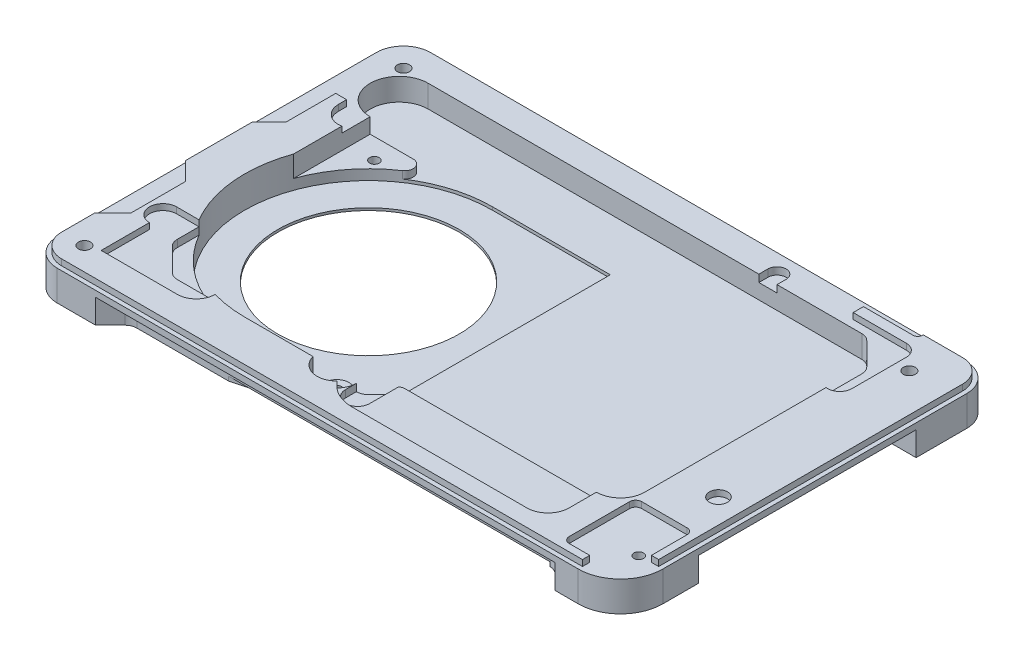
from build123d import *

# Parameters (mm, degrees)
BOSS_EXTRUDE2_DEPTH = 5
CUT_EXTRUDE2_DEPTH  = 4
BOSS_EXTRUDE4_START = 1.2
BOSS_EXTRUDE4_DEPTH = 1.2
CUT_EXTRUDE4_REACH  = 69.347
CUT_EXTRUDE5_DEPTH  = 1
SKETCH13_R          = 1
SKETCH13_R_2        = 0.8
CUT_EXTRUDE6_DEPTH  = 58.935434753
CUT_EXTRUDE8_DEPTH  = 0.7
CUT_EXTRUDE10_DEPTH = 3.7
BOSS_EXTRUDE5_START = 1
SKETCH17_R          = 1
SKETCH17_R_2        = 1.5
BOSS_EXTRUDE5_DEPTH = 1
CUT_EXTRUDE11_DEPTH = 1.2
SKETCH19_R          = 20
CUT_EXTRUDE12_DEPTH = 0.4
SKETCH20_R          = 15
CUT_EXTRUDE13_DEPTH = 59.067844802
CUT_EXTRUDE14_DEPTH = 0.5
BOSS_EXTRUDE6_START = 1.2
SKETCH23_R          = 0.8
BOSS_EXTRUDE6_DEPTH = 1.2
BOSS_EXTRUDE7_START = 2.5
BOSS_EXTRUDE7_DEPTH = 2.5


with BuildPart() as part:
    # Sketch5 → Boss-Extrude2 (new body)
    with BuildSketch(Plane(origin=(0, 0, 0), x_dir=(1, 0, 0), z_dir=(0, 1, 0))):
        with BuildLine():
            Line((-44.35, -30.89), (41.85, -30.89))
            ThreePointArc((41.85, -30.89), (46.799747468, -28.839747468), (48.85, -23.89))
            Line((48.85, -23.89), (48.85, 26.39))
            ThreePointArc((48.85, 26.39), (47.531980515, 29.571980515), (44.35, 30.89))
            Line((44.35, 30.89), (-44.35, 30.89))
            ThreePointArc((-44.35, 30.89), (-47.531980515, 29.571980515), (-48.85, 26.39))
            Line((-48.85, 26.39), (-48.85, -26.39))
            ThreePointArc((-48.85, -26.39), (-47.531980515, -29.571980515), (-44.35, -30.89))
        make_face()
    extrude(amount=BOSS_EXTRUDE2_DEPTH)

    # Sketch10 → Cut-Extrude2 (cut)
    with BuildSketch(Plane.XZ):
        with BuildLine():
            Line((-48.85, 18), (-44.435786438, 13.585786438))
            ThreePointArc((-44.435786438, 13.585786438), (-44.002240935, 12.93693974), (-43.85, 12.171572875))
            Line((-43.85, 12.171572875), (-43.85, -12.171572875))
            ThreePointArc((-43.85, -12.171572875), (-44.002240935, -12.93693974), (-44.435786438, -13.585786438))
            Line((-44.435786438, -13.585786438), (-48.85, -18))
            Line((-48.85, -18), (-48.85, 18))
        make_face()
        with BuildLine():
            Line((-38, -30.89), (-35.585786438, -28.475786438))
            ThreePointArc((-35.585786438, -28.475786438), (-34.93693974, -28.042240935), (-34.171572875, -27.89))
            Line((-34.171572875, -27.89), (34.171572875, -27.89))
            ThreePointArc((34.171572875, -27.89), (34.93693974, -28.042240935), (35.585786438, -28.475786438))
            Line((35.585786438, -28.475786438), (38, -30.89))
            Line((38, -30.89), (-38, -30.89))
        make_face()
        with BuildLine():
            Line((-38, 30.89), (38, 30.89))
            Line((38, 30.89), (35.585786438, 28.475786438))
            ThreePointArc((35.585786438, 28.475786438), (34.93693974, 28.042240935), (34.171572875, 27.89))
            Line((34.171572875, 27.89), (-34.171572875, 27.89))
            ThreePointArc((-34.171572875, 27.89), (-34.93693974, 28.042240935), (-35.585786438, 28.475786438))
            Line((-35.585786438, 28.475786438), (-38, 30.89))
        make_face()
        with BuildLine():
            Line((36.85, 18), (48.85, 18))
            Line((48.85, 18), (48.85, -18))
            Line((48.85, -18), (36.85, -18))
            ThreePointArc((36.85, -18), (35.45, -16.6), (36.85, -15.2))
            Line((36.85, -15.2), (44.85, -15.2))
            Line((44.85, -15.2), (44.85, -14.1))
            Line((44.85, -14.1), (36.85, -14.1))
            ThreePointArc((36.85, -14.1), (35.772222222, -13.022222222), (36.85, -11.944444444))
            Line((36.85, -11.944444444), (44.85, -11.944444444))
            Line((44.85, -11.944444444), (44.85, -10.844444444))
            Line((44.85, -10.844444444), (36.85, -10.844444444))
            ThreePointArc((36.85, -10.844444444), (35.772222222, -9.766666667), (36.85, -8.688888889))
            Line((36.85, -8.688888889), (44.85, -8.688888889))
            Line((44.85, -8.688888889), (44.85, -7.588888889))
            Line((44.85, -7.588888889), (36.85, -7.588888889))
            ThreePointArc((36.85, -7.588888889), (35.772222222, -6.511111111), (36.85, -5.433333333))
            Line((36.85, -5.433333333), (44.85, -5.433333333))
            Line((44.85, -5.433333333), (44.85, -4.333333333))
            Line((44.85, -4.333333333), (36.85, -4.333333333))
            ThreePointArc((36.85, -4.333333333), (35.772222222, -3.255555556), (36.85, -2.177777778))
            Line((36.85, -2.177777778), (44.85, -2.177777778))
            Line((44.85, -2.177777778), (44.85, -1.077777778))
            Line((44.85, -1.077777778), (36.85, -1.077777778))
            ThreePointArc((36.85, -1.077777778), (35.772222222, 0), (36.85, 1.077777778))
            Line((36.85, 1.077777778), (44.85, 1.077777778))
            Line((44.85, 1.077777778), (44.85, 2.177777778))
            Line((44.85, 2.177777778), (36.85, 2.177777778))
            ThreePointArc((36.85, 2.177777778), (35.772222222, 3.255555556), (36.85, 4.333333333))
            Line((36.85, 4.333333333), (44.85, 4.333333333))
            Line((44.85, 4.333333333), (44.85, 5.433333333))
            Line((44.85, 5.433333333), (36.85, 5.433333333))
            ThreePointArc((36.85, 5.433333333), (35.772222222, 6.511111111), (36.85, 7.588888889))
            Line((36.85, 7.588888889), (44.85, 7.588888889))
            Line((44.85, 7.588888889), (44.85, 8.688888889))
            Line((44.85, 8.688888889), (36.85, 8.688888889))
            ThreePointArc((36.85, 8.688888889), (35.772222222, 9.766666667), (36.85, 10.844444444))
            Line((36.85, 10.844444444), (44.85, 10.844444444))
            Line((44.85, 10.844444444), (44.85, 11.944444444))
            Line((44.85, 11.944444444), (36.85, 11.944444444))
            ThreePointArc((36.85, 11.944444444), (35.772222222, 13.022222222), (36.85, 14.1))
            Line((36.85, 14.1), (44.85, 14.1))
            Line((44.85, 14.1), (44.85, 15.2))
            Line((44.85, 15.2), (36.85, 15.2))
            ThreePointArc((36.85, 15.2), (35.45, 16.6), (36.85, 18))
        make_face()
    extrude(amount=-CUT_EXTRUDE2_DEPTH, mode=Mode.SUBTRACT)

    # Sketch11 → Boss-Extrude4 (add)
    with BuildSketch(Plane.XZ.offset(-4).offset(BOSS_EXTRUDE4_START)):
        with BuildLine():
            Line((-35.585786438, -28.475786438), (-36.5, -29.39))
            Line((-36.5, -29.39), (36.5, -29.39))
            Line((36.5, -29.39), (35.585786438, -28.475786438))
            ThreePointArc((35.585786438, -28.475786438), (34.93693974, -28.042240935), (34.171572875, -27.89))
            Line((34.171572875, -27.89), (-34.171572875, -27.89))
            ThreePointArc((-34.171572875, -27.89), (-34.93693974, -28.042240935), (-35.585786438, -28.475786438))
        make_face()
        with BuildLine():
            Line((-36.5, 29.39), (-35.585786438, 28.475786438))
            ThreePointArc((-35.585786438, 28.475786438), (-34.93693974, 28.042240935), (-34.171572875, 27.89))
            Line((-34.171572875, 27.89), (34.171572875, 27.89))
            ThreePointArc((34.171572875, 27.89), (34.93693974, 28.042240935), (35.585786438, 28.475786438))
            Line((35.585786438, 28.475786438), (36.5, 29.39))
            Line((36.5, 29.39), (-36.5, 29.39))
        make_face()
    extrude(amount=-BOSS_EXTRUDE4_DEPTH)

    # Cut-Extrude4: up to this face of the body (flat: up to its plane)
    cut_extrude4_end = Plane(part.part.faces().sort_by_distance((40.85, 2, 15.2))[0])
    # Sketch12 → Cut-Extrude4 (cut, up to the picked face)
    with BuildSketch(Plane(origin=(0, 0, -15.2), x_dir=(-1, 0, 0), z_dir=(0, 0, -1)), mode=Mode.PRIVATE) as cut_extrude4_sk1:
        Polygon((-44.85, 4), (-36.85, 0), (-44.85, 0), align=None)
    cut_extrude4_tool1 = split(extrude(cut_extrude4_sk1.sketch, amount=-CUT_EXTRUDE4_REACH, mode=Mode.PRIVATE), bisect_by=cut_extrude4_end, keep=Keep.BOTH, mode=Mode.PRIVATE)
    add(cut_extrude4_tool1.solids().sort_by(Axis((42.183333, 1.333333, -15.2), (0, 0, 1)))[0], mode=Mode.SUBTRACT)

    # Sketch6 → Cut-Extrude5 (cut)
    with BuildSketch(Plane.XZ):
        with BuildLine():
            Line((-47.95, 26.39), (-47.95, 20.236616051))
            ThreePointArc((-47.95, 20.236616051), (-47.575727394, 19.456574239), (-46.733069542, 19.260428991))
            Line((-46.733069542, 19.260428991), (-39.733069542, 20.815984546))
            ThreePointArc((-39.733069542, 20.815984546), (-39.169958188, 21.166444213), (-38.95, 21.792171606))
            Line((-38.95, 21.792171606), (-38.95, 28.99))
            ThreePointArc((-38.95, 28.99), (-39.242893219, 29.697106781), (-39.95, 29.99))
            Line((-39.95, 29.99), (-44.35, 29.99))
            ThreePointArc((-44.35, 29.99), (-46.895584412, 28.935584412), (-47.95, 26.39))
        make_face()
        with BuildLine():
            Line((39.95, 29.99), (41.85, 29.99))
            ThreePointArc((41.85, 29.99), (46.163351365, 28.203351365), (47.95, 23.89))
            Line((47.95, 23.89), (47.95, 20.236616051))
            ThreePointArc((47.95, 20.236616051), (47.575727394, 19.456574239), (46.733069542, 19.260428991))
            Line((46.733069542, 19.260428991), (39.733069542, 20.815984546))
            ThreePointArc((39.733069542, 20.815984546), (39.169958188, 21.166444213), (38.95, 21.792171606))
            Line((38.95, 21.792171606), (38.95, 28.99))
            ThreePointArc((38.95, 28.99), (39.242893219, 29.697106781), (39.95, 29.99))
        make_face()
        with BuildLine():
            Line((48.765806971, -22.89), (47.95, -20.236616051))
            ThreePointArc((47.95, -20.236616051), (47.575727394, -19.456574239), (46.733069542, -19.260428991))
            Line((46.733069542, -19.260428991), (39.733069542, -20.815984546))
            ThreePointArc((39.733069542, -20.815984546), (39.169958188, -21.166444213), (38.95, -21.792171606))
            Line((38.95, -21.792171606), (38.95, -28.99))
            ThreePointArc((38.95, -28.99), (39.242893219, -29.697106781), (39.95, -29.99))
            Line((39.95, -29.99), (44.499911272, -30.355783503))
            ThreePointArc((44.499911272, -30.355783503), (47.917142837, -27.35672235), (48.765806971, -22.89))
        make_face()
        with BuildLine():
            Line((-39.95, -29.99), (-44.35, -29.99))
            ThreePointArc((-44.35, -29.99), (-46.895584412, -28.935584412), (-47.95, -26.39))
            Line((-47.95, -26.39), (-47.95, -20.236616051))
            ThreePointArc((-47.95, -20.236616051), (-47.575727394, -19.456574239), (-46.733069542, -19.260428991))
            Line((-46.733069542, -19.260428991), (-39.733069542, -20.815984546))
            ThreePointArc((-39.733069542, -20.815984546), (-39.169958188, -21.166444213), (-38.95, -21.792171606))
            Line((-38.95, -21.792171606), (-38.95, -28.99))
            ThreePointArc((-38.95, -28.99), (-39.242893219, -29.697106781), (-39.95, -29.99))
        make_face()
    extrude(amount=-CUT_EXTRUDE5_DEPTH, mode=Mode.SUBTRACT)

    # Sketch13 → Cut-Extrude6 (cut, through all)
    with BuildSketch(Plane.XZ.offset(-1)):
        with Locations(Location((-44.35, 26.39, 0), (0, 0, 270))):
            Circle(SKETCH13_R)
        with Locations(Location((-44.35, -26.39, 0), (0, 0, 270))):
            Circle(SKETCH13_R)
        with Locations(Location((41.85, -23.89, 0), (0, 0, 270))):
            Circle(SKETCH13_R)
        with Locations(Location((44.95, 23.99, 0), (0, 0, 270))):
            Circle(SKETCH13_R_2)
    extrude(amount=-CUT_EXTRUDE6_DEPTH, mode=Mode.SUBTRACT)

    # Sketch15 → Cut-Extrude8 (cut)
    with BuildSketch(Plane.XZ):
        with BuildLine():
            Line((-19, 27.89), (22.593753701, 16.89))
            ThreePointArc((22.593753701, 16.89), (23.62588171, 16.89252022), (24.519313117, 17.409313117))
            Line((24.519313117, 17.409313117), (35, 27.89))
            Line((35, 27.89), (-19, 27.89))
        make_face()
        with BuildLine():
            Line((35, -27.89), (-19, -27.89))
            Line((-19, -27.89), (22.593753701, -16.89))
            ThreePointArc((22.593753701, -16.89), (23.62588171, -16.89252022), (24.519313117, -17.409313117))
            Line((24.519313117, -17.409313117), (35, -27.89))
        make_face()
    extrude(amount=-CUT_EXTRUDE8_DEPTH, mode=Mode.SUBTRACT)

    # Sketch16 → Cut-Extrude10 (cut)
    with BuildSketch(Plane(origin=(0, 5, 0), x_dir=(1, 0, 0), z_dir=(0, 1, 0))):
        with BuildLine():
            Line((-40.15, 26.29), (31.571825407, 26.29))
            ThreePointArc((31.571825407, 26.29), (32.337192272, 26.137759065), (32.986038969, 25.704213562))
            Line((32.986038969, 25.704213562), (36.764213562, 21.926038969))
            ThreePointArc((36.764213562, 21.926038969), (37.197759065, 21.277192272), (37.35, 20.511825407))
            Line((37.35, 20.511825407), (37.35, -15.39))
            ThreePointArc((37.35, -15.39), (36.178427125, -18.218427125), (33.35, -19.39))
            Line((33.35, -19.39), (1.806854249, -19.39))
            ThreePointArc((1.806854249, -19.39), (1.041487385, -19.542240935), (0.392640687, -19.975786438))
            Line((0.392640687, -19.975786438), (-1.685786438, -22.054213562))
            ThreePointArc((-1.685786438, -22.054213562), (-2.334633135, -22.487759065), (-3.1, -22.64))
            ThreePointArc((-3.1, -22.64), (-5.972443644, -25.867994919), (-9.51227766, -23.39))
            Line((-9.51227766, -23.39), (-20.85, -23.39))
            ThreePointArc((-20.85, -23.39), (-23.713564213, -23.189014754), (-26.520978752, -22.59))
            Line((-26.520978752, -22.59), (-32.771825407, -22.59))
            ThreePointArc((-32.771825407, -22.59), (-33.537192272, -22.437759065), (-34.186038969, -22.004213562))
            Line((-34.186038969, -22.004213562), (-37.964213562, -18.226038969))
            ThreePointArc((-37.964213562, -18.226038969), (-38.397759065, -17.577192272), (-38.55, -16.811825407))
            Line((-38.55, -16.811825407), (-38.55, -13.232146779))
            ThreePointArc((-38.55, -13.232146779), (-41.262412143, -4.782995112), (-40.15, 4.020861017))
            Line((-40.15, 4.020861017), (-40.15, 16.69))
            ThreePointArc((-40.15, 16.69), (-44.95, 21.49), (-40.15, 26.29))
        make_face()
    extrude(amount=-CUT_EXTRUDE10_DEPTH, mode=Mode.SUBTRACT)

    # Sketch17 → Boss-Extrude5 (add)
    with BuildSketch(Plane(origin=(0, 5, 0), x_dir=(1, 0, 0), z_dir=(0, 1, 0)).offset(BOSS_EXTRUDE5_START)):
        with BuildLine():
            Line((-45.15, -17.89), (-48.15, -20.89))
            Line((-48.15, -20.89), (-48.15, -26.39))
            ThreePointArc((-48.15, -26.39), (-47.037005769, -29.077005769), (-44.35, -30.19))
            Line((-44.35, -30.19), (41.85, -30.19))
            Line((41.85, -30.19), (41.85, -28.99))
            Line((41.85, -28.99), (38.45, -28.99))
            ThreePointArc((38.45, -28.99), (37.742893219, -28.697106781), (37.45, -27.99))
            Line((37.45, -27.99), (37.45, -17.99))
            ThreePointArc((37.45, -17.99), (37.742893219, -17.282893219), (38.45, -16.99))
            Line((38.45, -16.99), (45.95, -16.99))
            ThreePointArc((45.95, -16.99), (46.657106781, -17.282893219), (46.95, -17.99))
            Line((46.95, -17.99), (46.95, -23.89))
            Line((46.95, -23.89), (48.15, -23.89))
            Line((48.15, -23.89), (48.15, 26.39))
            ThreePointArc((48.15, 26.39), (47.037005769, 29.077005769), (44.35, 30.19))
            Line((44.35, 30.19), (37.85, 30.19))
            Line((37.85, 30.19), (37.85, 30.09))
            ThreePointArc((37.85, 30.09), (37.615685425, 29.524314575), (37.05, 29.29))
            Line((37.05, 29.29), (28.85, 29.29))
            Line((28.85, 29.29), (28.85, 27.59))
            Line((28.85, 27.59), (37.65, 27.59))
            ThreePointArc((37.65, 27.59), (39.064213562, 27.004213562), (39.65, 25.59))
            Line((39.65, 25.59), (39.65, 16.59))
            ThreePointArc((39.65, 16.59), (39.064213562, 15.175786438), (37.65, 14.59))
            Line((37.65, 14.59), (37.35, 14.59))
            Line((37.35, 14.59), (37.35, -15.39))
            ThreePointArc((37.35, -15.39), (36.178427125, -18.218427125), (33.35, -19.39))
            Line((33.35, -19.39), (33.35, -23.89))
            ThreePointArc((33.35, -23.89), (32.324873734, -26.364873734), (29.85, -27.39))
            Line((29.85, -27.39), (0.885281374, -27.39))
            ThreePointArc((0.885281374, -27.39), (-1.41081922, -26.933277195), (-3.357359313, -25.632640687))
            Line((-3.357359313, -25.632640687), (-4.051902961, -24.938097039))
            ThreePointArc((-4.051902961, -24.938097039), (-7.236483585, -25.766762999), (-9.51227766, -23.39))
            Line((-9.51227766, -23.39), (-20.85, -23.39))
            ThreePointArc((-20.85, -23.39), (-23.713564213, -23.189014754), (-26.520978752, -22.59))
            ThreePointArc((-26.520978752, -22.59), (-27.43639405, -24.800008029), (-29.646402079, -25.715423328))
            Line((-29.646402079, -25.715423328), (-42.25, -25.715423328))
            Line((-42.25, -25.715423328), (-42.25, -17.732146779))
            ThreePointArc((-42.25, -17.732146779), (-44.5, -15.482146779), (-42.25, -13.232146779))
            Line((-42.25, -13.232146779), (-38.55, -13.232146779))
            ThreePointArc((-38.55, -13.232146779), (-41.262412143, -4.782995112), (-40.15, 4.020861017))
            Line((-40.15, 4.020861017), (-40.15, 11.99))
            ThreePointArc((-40.15, 11.99), (-42.515475811, 12.62621104), (-43.55, 14.846571371))
            Line((-43.55, 14.846571371), (-43.55, 16.19))
            Line((-43.55, 16.19), (-45.35, 16.19))
            Line((-45.35, 16.19), (-45.35, 7.99))
            Line((-45.35, 7.99), (-48.15, 5.19))
            Line((-48.15, 5.19), (-48.15, -5.89))
            Line((-48.15, -5.89), (-45.15, -8.89))
            Line((-45.15, -8.89), (-45.15, -17.89))
        make_face()
        with Locations(Location((-44.35, -26.39, 0), (0, 0, 90))):
            Circle(SKETCH17_R, mode=Mode.SUBTRACT)
        with Locations(Location((44.15, -9.99, 0), (0, 0, 270))):
            Circle(SKETCH17_R_2, mode=Mode.SUBTRACT)
        with Locations(Location((41.85, 23.89, 0), (0, 0, 90))):
            Circle(SKETCH17_R, mode=Mode.SUBTRACT)
    extrude(amount=-BOSS_EXTRUDE5_DEPTH)

    # Sketch18 → Cut-Extrude11 (cut)
    with BuildSketch(Plane(origin=(0, 5, 0), x_dir=(1, 0, 0), z_dir=(0, 1, 0))):
        with BuildLine():
            Line((-3.1, -22.64), (-3.1, -24.44))
            ThreePointArc((-3.1, -24.44), (-1.1, -26.44), (0.9, -24.44))
            Line((0.9, -24.44), (0.9, -19.607413292))
            ThreePointArc((0.9, -19.607413292), (0.631795255, -19.771594501), (0.392640687, -19.975786438))
            Line((0.392640687, -19.975786438), (-1.685786438, -22.054213562))
            ThreePointArc((-1.685786438, -22.054213562), (-2.334633135, -22.487759065), (-3.1, -22.64))
        make_face()
        with BuildLine():
            Line((14.55, 26.29), (14.55, 27.79))
            ThreePointArc((14.55, 27.79), (16.05, 29.29), (17.55, 27.79))
            Line((17.55, 27.79), (17.55, 26.29))
            Line((17.55, 26.29), (14.55, 26.29))
        make_face()
    extrude(amount=-CUT_EXTRUDE11_DEPTH, mode=Mode.SUBTRACT)

    # Sketch19 → Cut-Extrude12 (cut)
    with BuildSketch(Plane.XZ):
        with Locations(Location((-20.85, 2.89, 0), (0, 0, 270))):
            Circle(SKETCH19_R)
    extrude(amount=-CUT_EXTRUDE12_DEPTH, mode=Mode.SUBTRACT)

    # Sketch20 → Cut-Extrude13 (cut, through all)
    with BuildSketch(Plane.XZ.offset(-0.4)):
        with Locations(Location((-20.85, 2.89, 0), (0, 0, 270))):
            Circle(SKETCH20_R)
    extrude(amount=-CUT_EXTRUDE13_DEPTH, mode=Mode.SUBTRACT)

    # Sketch21 → Cut-Extrude14 (cut)
    with BuildSketch(Plane(origin=(0, 1.3, 0), x_dir=(1, 0, 0), z_dir=(0, 1, 0))):
        with BuildLine():
            Line((-20.85, 17.61), (-1.35, 17.61))
            Line((-1.35, 17.61), (-1.35, -21.718427125))
            Line((-1.35, -21.718427125), (-1.685786438, -22.054213562))
            ThreePointArc((-1.685786438, -22.054213562), (-2.334633135, -22.487759065), (-3.1, -22.64))
            ThreePointArc((-3.1, -22.64), (-5.972443644, -25.867994919), (-9.51227766, -23.39))
            Line((-9.51227766, -23.39), (-20.85, -23.39))
            ThreePointArc((-20.85, -23.39), (-41.35, -2.89), (-20.85, 17.61))
        make_face()
    extrude(amount=-CUT_EXTRUDE14_DEPTH, mode=Mode.SUBTRACT)

    # Sketch23 → Boss-Extrude6 (add)
    # profile 1 of 2: a face of its own
    with BuildSketch(Plane(origin=(0, 1.3, 0), x_dir=(1, 0, 0), z_dir=(0, 1, 0)).offset(BOSS_EXTRUDE6_START)):
        with BuildLine():
            Line((-40.15, 16.69), (-40.15, 4.020861017))
            ThreePointArc((-40.15, 4.020861017), (-37.020318194, 9.710428942), (-32.268175674, 14.135723605))
            ThreePointArc((-32.268175674, 14.135723605), (-31.710429707, 15.70081288), (-33.045380584, 16.69))
            Line((-33.045380584, 16.69), (-40.15, 16.69))
        make_face()
        with Locations(Location((-36.05, 13.29, 0), (0, 0, 270))):
            Circle(SKETCH23_R, mode=Mode.SUBTRACT)
    # profile 2 of 2: a face of its own
    with BuildSketch(Plane(origin=(0, 1.3, 0), x_dir=(1, 0, 0), z_dir=(0, 1, 0)).offset(BOSS_EXTRUDE6_START)):
        with BuildLine():
            Line((-3.1, -22.64), (-3.521572875, -22.64))
            ThreePointArc((-3.521572875, -22.64), (-4.098923144, -22.456496581), (-4.464381917, -21.973333333))
            ThreePointArc((-4.464381917, -21.973333333), (-6.610619012, -20.657053271), (-8.343844893, -22.483211785))
            ThreePointArc((-8.343844893, -22.483211785), (-8.727666604, -23.194822417), (-9.51227766, -23.39))
            ThreePointArc((-9.51227766, -23.39), (-5.972443644, -25.867994919), (-3.1, -22.64))
        make_face()
        with Locations(Location((-6.35, -22.64, 0), (0, 0, 270))):
            Circle(SKETCH23_R, mode=Mode.SUBTRACT)
    extrude(amount=-BOSS_EXTRUDE6_DEPTH)

    # Sketch24 → Boss-Extrude7 (add)
    with BuildSketch(Plane(origin=(0, 1.3, 0), x_dir=(1, 0, 0), z_dir=(0, 1, 0)).offset(BOSS_EXTRUDE7_START)):
        with BuildLine():
            Line((-38.55, -13.232146779), (-38.55, -16.811825407))
            ThreePointArc((-38.55, -16.811825407), (-38.397759065, -17.577192272), (-37.964213562, -18.226038969))
            Line((-37.964213562, -18.226038969), (-34.186038969, -22.004213562))
            ThreePointArc((-34.186038969, -22.004213562), (-33.537192272, -22.437759065), (-32.771825407, -22.59))
            Line((-32.771825407, -22.59), (-26.520978752, -22.59))
            ThreePointArc((-26.520978752, -22.59), (-33.437414992, -19.070450668), (-38.55, -13.232146779))
        make_face()
    extrude(amount=-BOSS_EXTRUDE7_DEPTH)


solid = part.part
